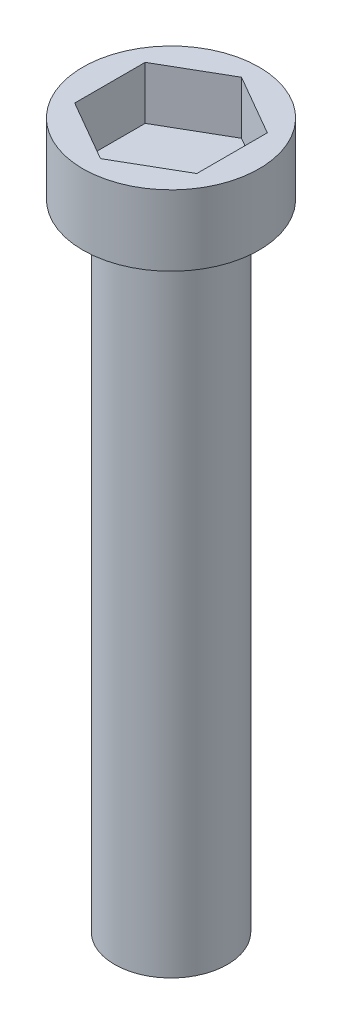
from build123d import *

# Parameters (mm, degrees)
SKETCH1_R           = 1.6
BOSS_EXTRUDE1_DEPTH = 18
SKETCH2_R           = 2.5
BOSS_EXTRUDE2_DEPTH = 2
CUT_EXTRUDE2_DEPTH  = 1.5


with BuildPart() as part:
    # Sketch1 → Boss-Extrude1 (new body)
    with BuildSketch(Plane(origin=(0, 0, 0), x_dir=(1, 0, 0), z_dir=(0, 1, 0))):
        Circle(SKETCH1_R)
    extrude(amount=BOSS_EXTRUDE1_DEPTH)

    # Sketch2 → Boss-Extrude2 (add)
    with BuildSketch(Plane(origin=(0, 18, 0), x_dir=(1, 0, 0), z_dir=(0, 1, 0))):
        Circle(SKETCH2_R)
    extrude(amount=BOSS_EXTRUDE2_DEPTH)

    # Sketch3 → Cut-Extrude2 (cut)
    with BuildSketch(Plane(origin=(0, 20, 0), x_dir=(1, 0, 0), z_dir=(0, 1, 0))):
        Polygon((0, 2), (-1.732050808, 1), (-1.732050808, -1), (0, -2), (1.732050808, -1), (1.732050808, 1), align=None)
    extrude(amount=-CUT_EXTRUDE2_DEPTH, mode=Mode.SUBTRACT)


solid = part.part
